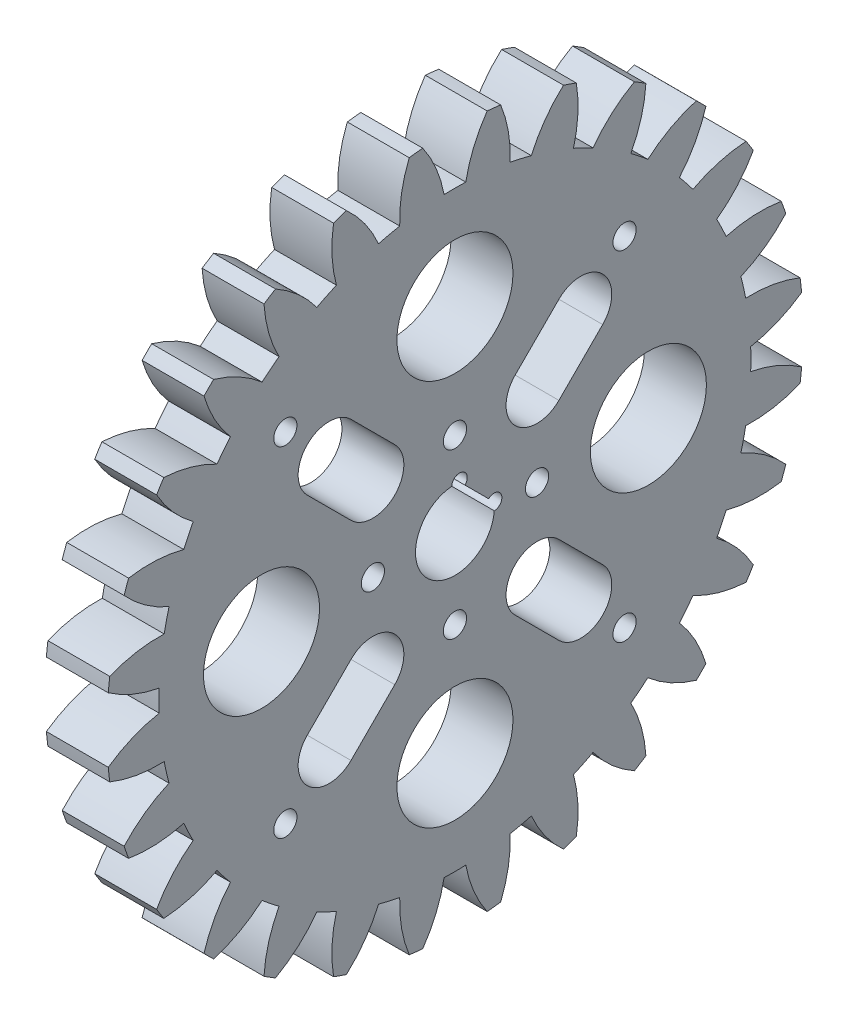
from build123d import *

# Parameters (mm, degrees)
SKETCH1_R           = 1.5
BOSS_EXTRUDE1_DEPTH = 4
SKETCH2_R           = 1.5
CUT_EXTRUDE1_DEPTH  = 64.492471961
SKETCH3_R           = 1.5
SKETCH3_R_2         = 7.5
SKETCH3_R_3         = 1
CUT_EXTRUDE2_DEPTH  = 64.492471961
MOVE_FACE1_BY       = 4


with BuildPart() as part:
    # Sketch1 → Boss-Extrude1 (new body)
    with BuildSketch(Plane(origin=(4, 0, 0), x_dir=(0, 0, -1), z_dir=(1, 0, 0))):
        with BuildLine():
            ThreePointArc((-44.806774018, 4.165693474), (-41.663456728, 2.430683539), (-38.223251988, 1.403213633))
            ThreePointArc((-38.223251988, 1.403213633), (-38.249, 0), (-38.223251988, -1.403213633))
            ThreePointArc((-38.223251988, -1.403213633), (-41.663456728, -2.430683539), (-44.806774018, -4.165693474))
            ThreePointArc((-44.806774018, -4.165693474), (-44.717049445, -5.038401425), (-44.610328647, -5.909194361))
            ThreePointArc((-44.610328647, -5.909194361), (-41.159744853, -6.901250075), (-37.577159665, -7.137441594))
            ThreePointArc((-37.577159665, -7.137441594), (-37.290017713, -8.511203203), (-36.952670849, -9.873505868))
            ThreePointArc((-36.952670849, -9.873505868), (-40.077988911, -11.64073253), (-42.756420642, -14.031696043))
            ThreePointArc((-42.756420642, -14.031696043), (-42.474749864, -14.862557788), (-42.176935122, -15.687770516))
            ThreePointArc((-42.176935122, -15.687770516), (-38.592111503, -15.887126193), (-35.046791649, -15.320195695))
            ThreePointArc((-35.046791649, -15.320195695), (-34.461158228, -16.595619138), (-33.829128493, -17.848699292))
            ThreePointArc((-33.829128493, -17.848699292), (-36.482843378, -20.267066586), (-38.562081801, -23.194090782))
            ThreePointArc((-38.562081801, -23.194090782), (-38.102588965, -23.941443443), (-37.628613953, -24.67969635))
            ThreePointArc((-37.628613953, -24.67969635), (-34.089308536, -24.076355465), (-30.759031156, -22.734731213))
            ThreePointArc((-30.759031156, -22.734731213), (-29.904272373, -23.847861431), (-29.009252376, -24.928884403))
            ThreePointArc((-29.009252376, -24.928884403), (-31.05829574, -27.877125294), (-32.434079157, -31.193436958))
            ThreePointArc((-32.434079157, -31.193436958), (-31.819805153, -31.819805153), (-31.193436958, -32.434079157))
            ThreePointArc((-31.193436958, -32.434079157), (-27.877125294, -31.05829574), (-24.928884403, -29.009252376))
            ThreePointArc((-24.928884403, -29.009252376), (-23.847861431, -29.904272373), (-22.734731213, -30.759031156))
            ThreePointArc((-22.734731213, -30.759031156), (-24.076355465, -34.089308536), (-24.67969635, -37.628613953))
            ThreePointArc((-24.67969635, -37.628613953), (-23.941443443, -38.102588965), (-23.194090782, -38.562081801))
            ThreePointArc((-23.194090782, -38.562081801), (-20.267066586, -36.482843378), (-17.848699292, -33.829128493))
            ThreePointArc((-17.848699292, -33.829128493), (-16.595619138, -34.461158228), (-15.320195695, -35.046791649))
            ThreePointArc((-15.320195695, -35.046791649), (-15.887126193, -38.592111503), (-15.687770516, -42.176935122))
            ThreePointArc((-15.687770516, -42.176935122), (-14.862557788, -42.474749864), (-14.031696043, -42.756420642))
            ThreePointArc((-14.031696043, -42.756420642), (-11.64073253, -40.077988911), (-9.873505868, -36.952670849))
            ThreePointArc((-9.873505868, -36.952670849), (-8.511203203, -37.290017713), (-7.137441594, -37.577159665))
            ThreePointArc((-7.137441594, -37.577159665), (-6.901250075, -41.159744853), (-5.909194361, -44.610328647))
            ThreePointArc((-5.909194361, -44.610328647), (-5.038401425, -44.717049445), (-4.165693474, -44.806774018))
            ThreePointArc((-4.165693474, -44.806774018), (-2.430683539, -41.663456728), (-1.403213633, -38.223251988))
            ThreePointArc((-1.403213633, -38.223251988), (0, -38.249), (1.403213633, -38.223251988))
            ThreePointArc((1.403213633, -38.223251988), (2.430683539, -41.663456728), (4.165693474, -44.806774018))
            ThreePointArc((4.165693474, -44.806774018), (5.038401425, -44.717049445), (5.909194361, -44.610328647))
            ThreePointArc((5.909194361, -44.610328647), (6.901250075, -41.159744853), (7.137441594, -37.577159665))
            ThreePointArc((7.137441594, -37.577159665), (8.511203203, -37.290017713), (9.873505868, -36.952670849))
            ThreePointArc((9.873505868, -36.952670849), (11.64073253, -40.077988911), (14.031696043, -42.756420642))
            ThreePointArc((14.031696043, -42.756420642), (14.862557788, -42.474749864), (15.687770516, -42.176935122))
            ThreePointArc((15.687770516, -42.176935122), (15.887126193, -38.592111503), (15.320195695, -35.046791649))
            ThreePointArc((15.320195695, -35.046791649), (16.595619138, -34.461158228), (17.848699292, -33.829128493))
            ThreePointArc((17.848699292, -33.829128493), (20.267066586, -36.482843378), (23.194090782, -38.562081801))
            ThreePointArc((23.194090782, -38.562081801), (23.941443443, -38.102588965), (24.67969635, -37.628613953))
            ThreePointArc((24.67969635, -37.628613953), (24.076355465, -34.089308536), (22.734731213, -30.759031156))
            ThreePointArc((22.734731213, -30.759031156), (23.847861431, -29.904272373), (24.928884403, -29.009252376))
            ThreePointArc((24.928884403, -29.009252376), (27.877125294, -31.05829574), (31.193436958, -32.434079157))
            ThreePointArc((31.193436958, -32.434079157), (31.819805153, -31.819805153), (32.434079157, -31.193436958))
            ThreePointArc((32.434079157, -31.193436958), (31.05829574, -27.877125294), (29.009252376, -24.928884403))
            ThreePointArc((29.009252376, -24.928884403), (29.904272373, -23.847861431), (30.759031156, -22.734731213))
            ThreePointArc((30.759031156, -22.734731213), (34.089308536, -24.076355465), (37.628613953, -24.67969635))
            ThreePointArc((37.628613953, -24.67969635), (38.102588965, -23.941443443), (38.562081801, -23.194090782))
            ThreePointArc((38.562081801, -23.194090782), (36.482843378, -20.267066586), (33.829128493, -17.848699292))
            ThreePointArc((33.829128493, -17.848699292), (34.461158228, -16.595619138), (35.046791649, -15.320195695))
            ThreePointArc((35.046791649, -15.320195695), (38.592111503, -15.887126193), (42.176935122, -15.687770516))
            ThreePointArc((42.176935122, -15.687770516), (42.474749864, -14.862557788), (42.756420642, -14.031696043))
            ThreePointArc((42.756420642, -14.031696043), (40.077988911, -11.64073253), (36.952670849, -9.873505868))
            ThreePointArc((36.952670849, -9.873505868), (37.290017713, -8.511203203), (37.577159665, -7.137441594))
            ThreePointArc((37.577159665, -7.137441594), (41.159744853, -6.901250075), (44.610328647, -5.909194361))
            ThreePointArc((44.610328647, -5.909194361), (44.717049445, -5.038401425), (44.806774018, -4.165693474))
            ThreePointArc((44.806774018, -4.165693474), (41.663456728, -2.430683539), (38.223251988, -1.403213633))
            ThreePointArc((38.223251988, -1.403213633), (38.249, 0), (38.223251988, 1.403213633))
            ThreePointArc((38.223251988, 1.403213633), (41.663456728, 2.430683539), (44.806774018, 4.165693474))
            ThreePointArc((44.806774018, 4.165693474), (44.717049445, 5.038401425), (44.610328647, 5.909194361))
            ThreePointArc((44.610328647, 5.909194361), (41.159744853, 6.901250075), (37.577159665, 7.137441594))
            ThreePointArc((37.577159665, 7.137441594), (37.290017713, 8.511203203), (36.952670849, 9.873505868))
            ThreePointArc((36.952670849, 9.873505868), (40.077988911, 11.64073253), (42.756420642, 14.031696043))
            ThreePointArc((42.756420642, 14.031696043), (42.474749864, 14.862557788), (42.176935122, 15.687770516))
            ThreePointArc((42.176935122, 15.687770516), (38.592111503, 15.887126193), (35.046791649, 15.320195695))
            ThreePointArc((35.046791649, 15.320195695), (34.461158228, 16.595619138), (33.829128493, 17.848699292))
            ThreePointArc((33.829128493, 17.848699292), (36.482843378, 20.267066586), (38.562081801, 23.194090782))
            ThreePointArc((38.562081801, 23.194090782), (38.102588965, 23.941443443), (37.628613953, 24.67969635))
            ThreePointArc((37.628613953, 24.67969635), (34.089308536, 24.076355465), (30.759031156, 22.734731213))
            ThreePointArc((30.759031156, 22.734731213), (29.904272373, 23.847861431), (29.009252376, 24.928884403))
            ThreePointArc((29.009252376, 24.928884403), (31.05829574, 27.877125294), (32.434079157, 31.193436958))
            ThreePointArc((32.434079157, 31.193436958), (31.819805153, 31.819805153), (31.193436958, 32.434079157))
            ThreePointArc((31.193436958, 32.434079157), (27.877125294, 31.05829574), (24.928884403, 29.009252376))
            ThreePointArc((24.928884403, 29.009252376), (23.847861431, 29.904272373), (22.734731213, 30.759031156))
            ThreePointArc((22.734731213, 30.759031156), (24.076355465, 34.089308536), (24.67969635, 37.628613953))
            ThreePointArc((24.67969635, 37.628613953), (23.941443443, 38.102588965), (23.194090782, 38.562081801))
            ThreePointArc((23.194090782, 38.562081801), (20.267066586, 36.482843378), (17.848699292, 33.829128493))
            ThreePointArc((17.848699292, 33.829128493), (16.595619138, 34.461158228), (15.320195695, 35.046791649))
            ThreePointArc((15.320195695, 35.046791649), (15.887126193, 38.592111503), (15.687770516, 42.176935122))
            ThreePointArc((15.687770516, 42.176935122), (14.862557788, 42.474749864), (14.031696043, 42.756420642))
            ThreePointArc((14.031696043, 42.756420642), (11.64073253, 40.077988911), (9.873505868, 36.952670849))
            ThreePointArc((9.873505868, 36.952670849), (8.511203203, 37.290017713), (7.137441594, 37.577159665))
            ThreePointArc((7.137441594, 37.577159665), (6.901250075, 41.159744853), (5.909194361, 44.610328647))
            ThreePointArc((5.909194361, 44.610328647), (5.038401425, 44.717049445), (4.165693474, 44.806774018))
            ThreePointArc((4.165693474, 44.806774018), (2.430683539, 41.663456728), (1.403213633, 38.223251988))
            ThreePointArc((1.403213633, 38.223251988), (0, 38.249), (-1.403213633, 38.223251988))
            ThreePointArc((-1.403213633, 38.223251988), (-2.430683539, 41.663456728), (-4.165693474, 44.806774018))
            ThreePointArc((-4.165693474, 44.806774018), (-5.038401425, 44.717049445), (-5.909194361, 44.610328647))
            ThreePointArc((-5.909194361, 44.610328647), (-6.901250075, 41.159744853), (-7.137441594, 37.577159665))
            ThreePointArc((-7.137441594, 37.577159665), (-8.511203203, 37.290017713), (-9.873505868, 36.952670849))
            ThreePointArc((-9.873505868, 36.952670849), (-11.64073253, 40.077988911), (-14.031696043, 42.756420642))
            ThreePointArc((-14.031696043, 42.756420642), (-14.862557788, 42.474749864), (-15.687770516, 42.176935122))
            ThreePointArc((-15.687770516, 42.176935122), (-15.887126193, 38.592111503), (-15.320195695, 35.046791649))
            ThreePointArc((-15.320195695, 35.046791649), (-16.595619138, 34.461158228), (-17.848699292, 33.829128493))
            ThreePointArc((-17.848699292, 33.829128493), (-20.267066586, 36.482843378), (-23.194090782, 38.562081801))
            ThreePointArc((-23.194090782, 38.562081801), (-23.941443443, 38.102588965), (-24.67969635, 37.628613953))
            ThreePointArc((-24.67969635, 37.628613953), (-24.076355465, 34.089308536), (-22.734731213, 30.759031156))
            ThreePointArc((-22.734731213, 30.759031156), (-23.847861431, 29.904272373), (-24.928884403, 29.009252376))
            ThreePointArc((-24.928884403, 29.009252376), (-27.877125294, 31.05829574), (-31.193436958, 32.434079157))
            ThreePointArc((-31.193436958, 32.434079157), (-31.819805153, 31.819805153), (-32.434079157, 31.193436958))
            ThreePointArc((-32.434079157, 31.193436958), (-31.05829574, 27.877125294), (-29.009252376, 24.928884403))
            ThreePointArc((-29.009252376, 24.928884403), (-29.904272373, 23.847861431), (-30.759031156, 22.734731213))
            ThreePointArc((-30.759031156, 22.734731213), (-34.089308536, 24.076355465), (-37.628613953, 24.67969635))
            ThreePointArc((-37.628613953, 24.67969635), (-38.102588965, 23.941443443), (-38.562081801, 23.194090782))
            ThreePointArc((-38.562081801, 23.194090782), (-36.482843378, 20.267066586), (-33.829128493, 17.848699292))
            ThreePointArc((-33.829128493, 17.848699292), (-34.461158228, 16.595619138), (-35.046791649, 15.320195695))
            ThreePointArc((-35.046791649, 15.320195695), (-38.592111503, 15.887126193), (-42.176935122, 15.687770516))
            ThreePointArc((-42.176935122, 15.687770516), (-42.474749864, 14.862557788), (-42.756420642, 14.031696043))
            ThreePointArc((-42.756420642, 14.031696043), (-40.077988911, 11.64073253), (-36.952670849, 9.873505868))
            ThreePointArc((-36.952670849, 9.873505868), (-37.290017713, 8.511203203), (-37.577159665, 7.137441594))
            ThreePointArc((-37.577159665, 7.137441594), (-41.159744853, 6.901250075), (-44.610328647, 5.909194361))
            ThreePointArc((-44.610328647, 5.909194361), (-44.717049445, 5.038401425), (-44.806774018, 4.165693474))
        make_face()
        with Locations(Location((0, 0, 0), (0, 0, 180))):
            Circle(SKETCH1_R, mode=Mode.SUBTRACT)
    extrude(amount=-BOSS_EXTRUDE1_DEPTH)

    # Sketch2 → Cut-Extrude1 (cut, through all)
    with BuildSketch(Plane(origin=(4, 0, 0), x_dir=(0, 0, -1), z_dir=(1, 0, 0))):
        with Locations((0, 10.606601718)):
            Circle(SKETCH2_R)
        with Locations((10.606601718, 0)):
            Circle(SKETCH2_R)
        with Locations((0, -10.606601718)):
            Circle(SKETCH2_R)
        with Locations((-10.606601718, 0)):
            Circle(SKETCH2_R)
        with BuildLine():
            Line((5.065612857, 0.591241393), (0.591241393, 5.065612857))
            ThreePointArc((0.591241393, 5.065612857), (-3.606244584, -3.606244584), (5.065612857, 0.591241393))
        make_face()
    extrude(amount=-CUT_EXTRUDE1_DEPTH, mode=Mode.SUBTRACT)

    # Sketch3 → Cut-Extrude2 (cut, through all)
    with BuildSketch(Plane(origin=(4, 0, 0), x_dir=(0, 0, -1), z_dir=(1, 0, 0))):
        with Locations((-21.920310217, 21.920310217)):
            Circle(SKETCH3_R)
        with Locations((0, 25)):
            Circle(SKETCH3_R_2)
        with Locations((25, 0)):
            Circle(SKETCH3_R_2)
        with Locations((21.920310217, 21.920310217)):
            Circle(SKETCH3_R)
        with Locations((0, -25)):
            Circle(SKETCH3_R_2)
        with Locations((21.920310217, -21.920310217)):
            Circle(SKETCH3_R)
        with Locations((-25, 0)):
            Circle(SKETCH3_R_2)
        with Locations((-21.920310217, -21.920310217)):
            Circle(SKETCH3_R)
        with Locations((0.591241393, 5.065612857)):
            Circle(SKETCH3_R_3)
        with Locations((5.065612857, 0.591241393)):
            Circle(SKETCH3_R_3)
        with BuildLine():
            Line((-13.435028843, 19.091883092), (-7.778174593, 13.435028843))
            ThreePointArc((-7.778174593, 13.435028843), (-7.778174593, 7.778174593), (-13.435028843, 7.778174593))
            Line((-13.435028843, 7.778174593), (-19.091883092, 13.435028843))
            ThreePointArc((-19.091883092, 13.435028843), (-19.091883092, 19.091883092), (-13.435028843, 19.091883092))
        make_face()
        with BuildLine():
            Line((19.091883092, 13.435028843), (13.435028843, 7.778174593))
            ThreePointArc((13.435028843, 7.778174593), (7.778174593, 7.778174593), (7.778174593, 13.435028843))
            Line((7.778174593, 13.435028843), (13.435028843, 19.091883092))
            ThreePointArc((13.435028843, 19.091883092), (19.091883092, 19.091883092), (19.091883092, 13.435028843))
        make_face()
        with BuildLine():
            Line((13.435028843, -19.091883092), (7.778174593, -13.435028843))
            ThreePointArc((7.778174593, -13.435028843), (7.778174593, -7.778174593), (13.435028843, -7.778174593))
            Line((13.435028843, -7.778174593), (19.091883092, -13.435028843))
            ThreePointArc((19.091883092, -13.435028843), (19.091883092, -19.091883092), (13.435028843, -19.091883092))
        make_face()
        with BuildLine():
            Line((-19.091883092, -13.435028843), (-13.435028843, -7.778174593))
            ThreePointArc((-13.435028843, -7.778174593), (-7.778174593, -7.778174593), (-7.778174593, -13.435028843))
            Line((-7.778174593, -13.435028843), (-13.435028843, -19.091883092))
            ThreePointArc((-13.435028843, -19.091883092), (-19.091883092, -19.091883092), (-19.091883092, -13.435028843))
        make_face()
    extrude(amount=-CUT_EXTRUDE2_DEPTH, mode=Mode.SUBTRACT)

    # Move Face1: a face moved outward by 4.0
    extrude(part.faces().sort_by_distance((4, -35.845419214, 0))[0], amount=MOVE_FACE1_BY, dir=(1, 0, 0))


solid = part.part
